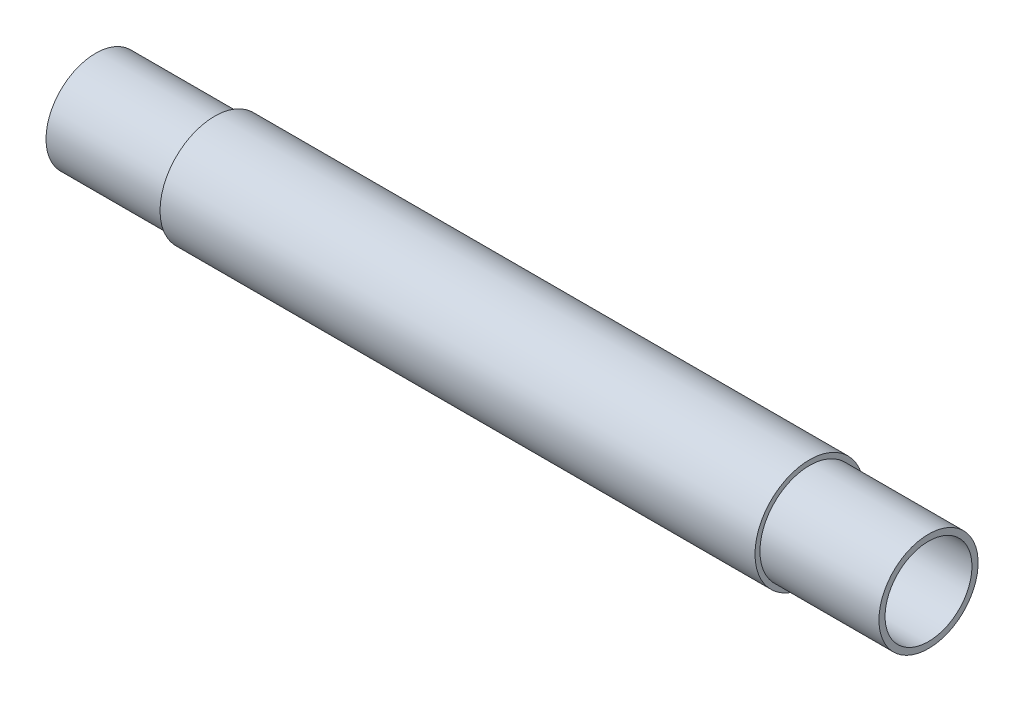
from build123d import *

# Parameters (mm, degrees)
SKETCH1_W          = 76.2
SKETCH1_H          = 6.985
SKETCH1_W_2        = 15.24
SKETCH1_H_2        = 6.35
SKETCH2_R          = 5.565762573
CUT_EXTRUDE1_DEPTH = 106.68


with BuildPart() as part:
    # Sketch1 → Revolve1 (revolve)
    with BuildSketch(Plane.XY, mode=Mode.PRIVATE) as revolve1_sk:
        with Locations((38.1, 3.4925)):
            Rectangle(SKETCH1_W, SKETCH1_H)
        with Locations((83.82, 3.175)):
            Rectangle(SKETCH1_W_2, SKETCH1_H_2)
        with Locations((-7.62, 3.175)):
            Rectangle(SKETCH1_W_2, SKETCH1_H_2)
    revolve(revolve1_sk.sketch.rotate(Axis((-92.340325691, 0, 0), (1, 0, 0)), 90), axis=Axis((-92.340325691, 0, 0), (1, 0, 0)))

    # Sketch2 → Cut-Extrude1 (cut)
    with BuildSketch(Plane(origin=(91.44, 0, 0), x_dir=(0, 0, -1), z_dir=(1, 0, 0))):
        Circle(SKETCH2_R)
    extrude(amount=-CUT_EXTRUDE1_DEPTH, mode=Mode.SUBTRACT)


solid = part.part
